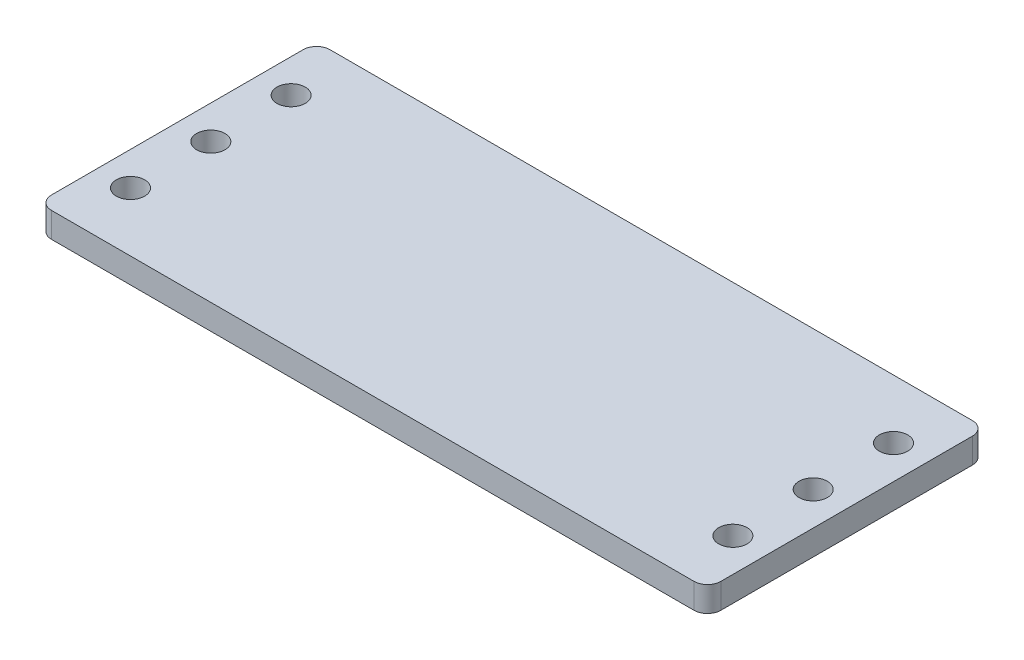
from build123d import *

# Parameters (mm, degrees)
SKETCH1_W           = 127
SKETCH1_H           = 52.832
BOSS_EXTRUDE1_DEPTH = 4.7625
FILLET1_R           = 2.54
SKETCH2_R           = 2.69
CUT_EXTRUDE1_DEPTH  = 69.940093286


with BuildPart() as part:
    # Sketch1 → Boss-Extrude1 (new body)
    with BuildSketch(Plane(origin=(0, 0, 0), x_dir=(1, 0, 0), z_dir=(0, 1, 0))):
        Rectangle(SKETCH1_W, SKETCH1_H)
    extrude(amount=BOSS_EXTRUDE1_DEPTH)

    # Fillet1
    fillet1_edges = [part.edges().sort_by_distance(p)[0] for p in [
        (63.5, 2.38125, 26.416),
        (-63.5, 2.38125, 26.416),
        (-63.5, 2.38125, -26.416),
        (63.5, 2.38125, -26.416),
    ]]
    fillet(fillet1_edges, radius=FILLET1_R)

    # Sketch2 → Cut-Extrude1 (cut, through all)
    with BuildSketch(Plane.XZ):
        with Locations(Location((57.15, -15.24, 0), (0, 0, 270))):
            Circle(SKETCH2_R)
        with Locations(Location((57.15, 0, 0), (0, 0, 270))):
            Circle(SKETCH2_R)
        with Locations(Location((57.15, 15.24, 0), (0, 0, 270))):
            Circle(SKETCH2_R)
    cut_extrude1 = extrude(amount=-CUT_EXTRUDE1_DEPTH, mode=Mode.SUBTRACT)

    # Mirror1: Cut-Extrude1 across plane
    add(cut_extrude1.mirror(Plane(origin=(0, 0, 0), x_dir=(0, 0, 1), z_dir=(1, 0, 0))), mode=Mode.SUBTRACT)


solid = part.part
